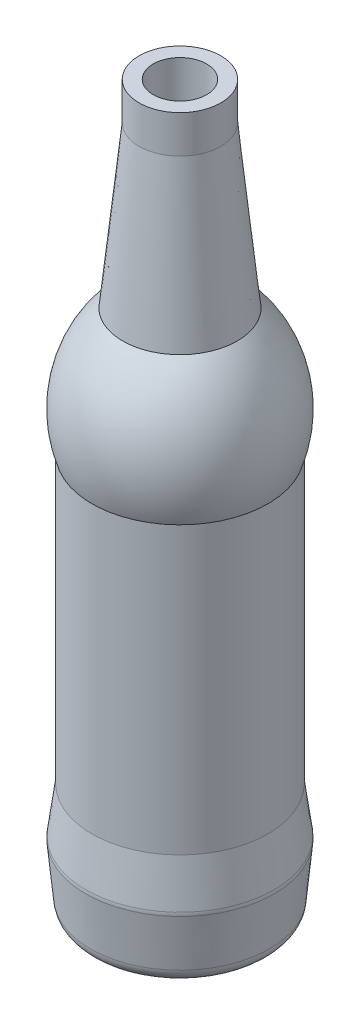
from build123d import *


with BuildPart() as part:
    # Schizzo1 → Rivoluzione1 (revolve)
    with BuildSketch(Plane.XY, mode=Mode.PRIVATE) as rivoluzione1_sk:
        with BuildLine():
            Line((0, 0), (-23.453565926, 0))
            ThreePointArc((-23.453565926, 0), (-26.81732667, 1.300660375), (-28.431043289, 4.525954537))
            Line((-28.431043289, 4.525954537), (-29.945842771, 20.431349098))
            ThreePointArc((-29.945842771, 20.431349098), (-29.967481843, 20.999388589), (-29.924504912, 21.566213162))
            Line((-29.924504912, 21.566213162), (-28, 36))
            Line((-28, 36), (-28, 127))
            ThreePointArc((-28, 127), (-28.901772547, 148.408088308), (-18.25, 167))
            Line((-18.25, 167), (-13, 218))
            Line((-13, 218), (-13, 230))
            Line((-13, 230), (-8.5, 230))
            Line((-8.5, 230), (-8.5, 225.5))
            Line((-8.5, 225.5), (-8.5, 217.76899273))
            Line((-8.5, 217.76899273), (-13.947509535, 164.850328678))
            ThreePointArc((-13.947509535, 164.850328678), (-24.422294077, 147.77127274), (-23.5, 127.757161803))
            Line((-23.5, 127.757161803), (-23.5, 35.701321612))
            Line((-23.5, 35.701321612), (-25.463979359, 20.971476422))
            ThreePointArc((-25.463979359, 20.971476422), (-25.468277052, 20.914793964), (-25.466113145, 20.857990015))
            Line((-25.466113145, 20.857990015), (-23.951313663, 4.952595454))
            ThreePointArc((-23.951313663, 4.952595454), (-23.789942001, 4.630066038), (-23.453565926, 4.5))
            Line((-23.453565926, 4.5), (0, 4.5))
            Line((0, 4.5), (0, 0))
        make_face()
    revolve(rivoluzione1_sk.sketch.rotate(Axis((0, 0, 0), (0, 1, 0)), 270), axis=Axis((0, 0, 0), (0, 1, 0)))


solid = part.part
